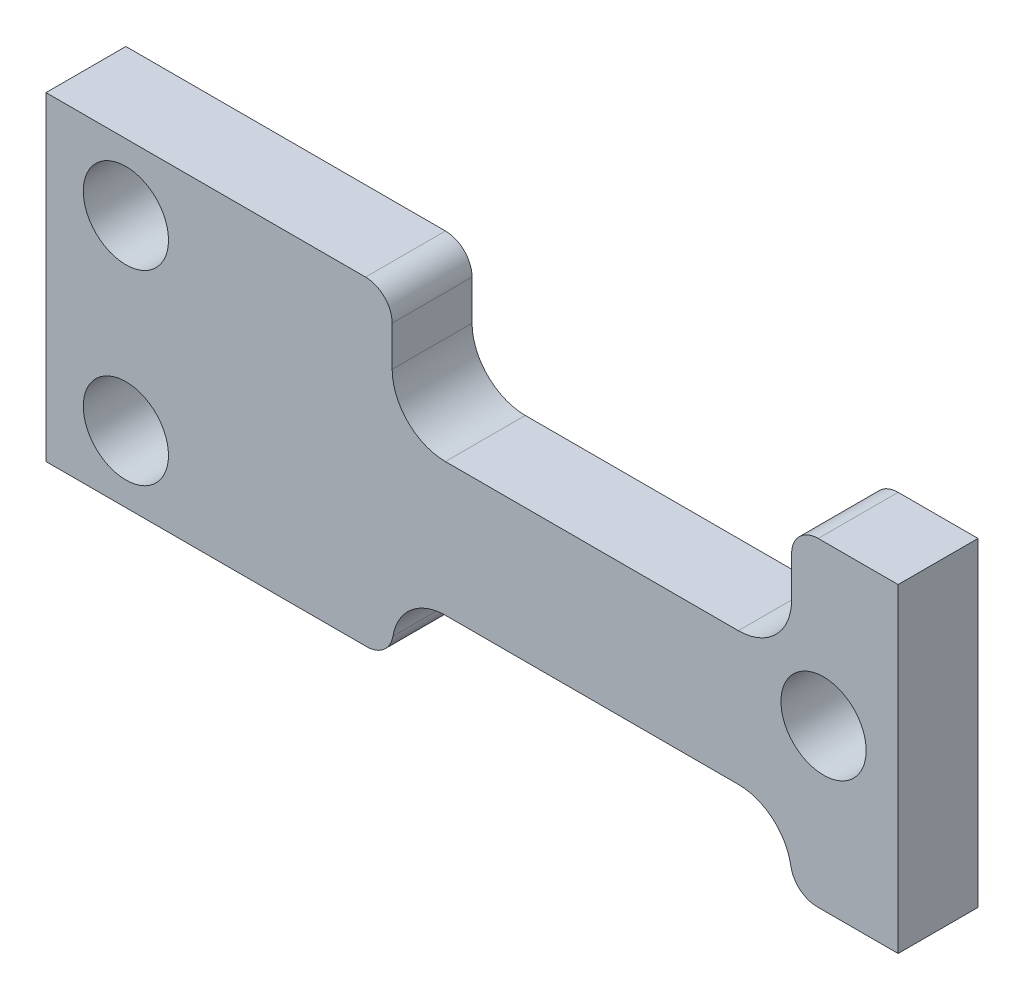
from build123d import *

# Parameters (mm, degrees)
SKETCH_1_R          = 1.6
SKETCH_1_W          = 15
SKETCH_1_H          = 6
EXTRUDE_1_DEPTH     = 3
FILLET_1_R          = 2
FILLET_2_R          = 3
SKETCH_2_R          = 1.6
SKETCH_2_W          = 32
SKETCH_2_H          = 12.112345176
CUT_EXTRUDE_1_DEPTH = 44.829670316
FILLET_3_R          = 1


with BuildPart() as part:
    # 草图1 → 凸台-拉伸1 (new body)
    with BuildSketch(Plane.XY):
        Polygon((0, 0), (0, 26.8), (12, 26.8), (12, 29.8), (22, 29.8), (22, 26.8), (32, 26.8), (32, 0), align=None)
        with Locations((3, 17)):
            Circle(SKETCH_1_R, mode=Mode.SUBTRACT)
        with Locations((3, 10)):
            Circle(SKETCH_1_R, mode=Mode.SUBTRACT)
        with Locations((20.5, 7)):
            Rectangle(SKETCH_1_W, SKETCH_1_H, mode=Mode.SUBTRACT)
        with Locations((20.5, 18)):
            Rectangle(SKETCH_1_W, SKETCH_1_H, mode=Mode.SUBTRACT)
    extrude(amount=EXTRUDE_1_DEPTH)

    # 圆角1
    fillet_1_edges = [part.edges().sort_by_distance(p)[0] for p in [
        (13, 10, 1.5),
        (13, 4, 1.5),
        (28, 4, 1.5),
        (28, 10, 1.5),
        (13, 21, 1.5),
        (13, 15, 1.5),
        (28, 15, 1.5),
        (28, 21, 1.5),
    ]]
    fillet(fillet_1_edges, radius=FILLET_1_R)

    # 圆角2
    fillet_2_edges = [part.edges().sort_by_distance(p)[0] for p in [
        (0, 0, 1.5),
        (32, 0, 1.5),
    ]]
    fillet(fillet_2_edges, radius=FILLET_2_R)

    # 草图2 → 切除-拉伸1 (cut, through all)
    with BuildSketch(Plane.XY.offset(3)):
        with Locations((29.2, 13.5)):
            Circle(SKETCH_2_R)
        with Locations((16, 25.556172588)):
            Rectangle(SKETCH_2_W, SKETCH_2_H)
        with Locations((16, 1.443827412)):
            Rectangle(SKETCH_2_W, SKETCH_2_H)
    extrude(amount=-CUT_EXTRUDE_1_DEPTH, mode=Mode.SUBTRACT)

    # 圆角3
    fillet_3_edges = [part.edges().sort_by_distance(p)[0] for p in [
        (28, 7.5, 1.5),
        (13, 7.5, 1.5),
        (13.063508327, 19.5, 1.5),
        (27.936491673, 19.5, 1.5),
    ]]
    fillet(fillet_3_edges, radius=FILLET_3_R)


solid = part.part
